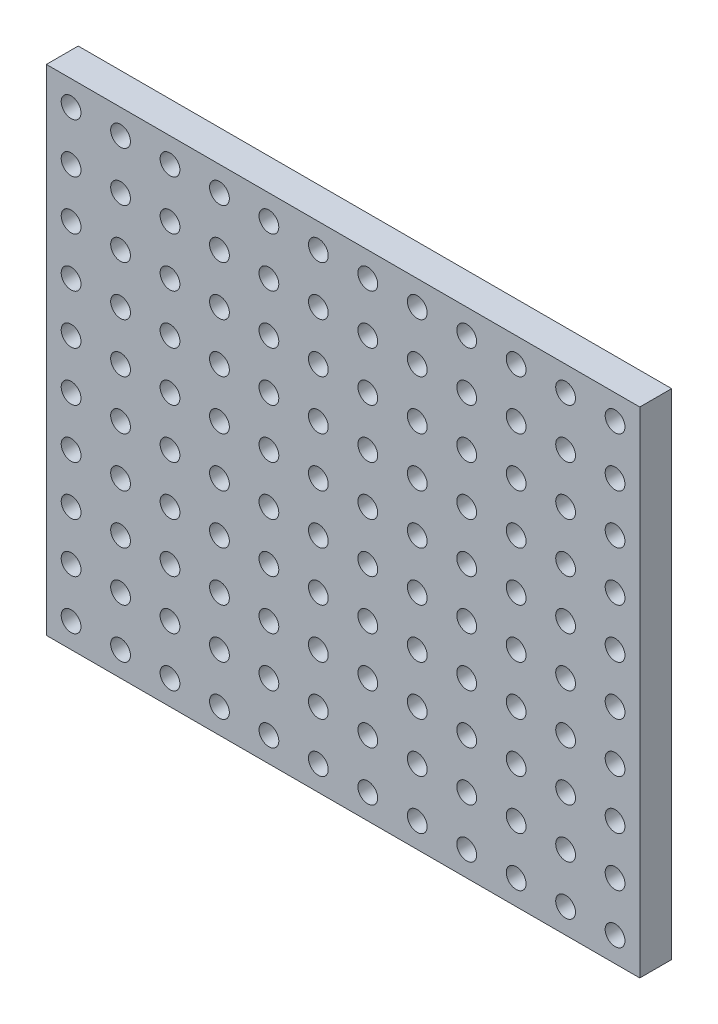
from build123d import *

# Parameters (mm, degrees)
SKETCH1_W           = 30
SKETCH1_H           = 25
SKETCH1_R           = 0.5
BOSS_EXTRUDE1_DEPTH = 1.61


with BuildPart() as part:
    # Sketch1 → Boss-Extrude1 (new body)
    with BuildSketch(Plane.XY):
        Rectangle(SKETCH1_W, SKETCH1_H)
        with Locations((-13.75, -11.25)):
            Circle(SKETCH1_R, mode=Mode.SUBTRACT)
        with Locations((-11.25, -11.25)):
            Circle(SKETCH1_R, mode=Mode.SUBTRACT)
        with Locations((-8.75, -11.25)):
            Circle(SKETCH1_R, mode=Mode.SUBTRACT)
        with Locations((-6.25, -11.25)):
            Circle(SKETCH1_R, mode=Mode.SUBTRACT)
        with Locations((-3.75, -11.25)):
            Circle(SKETCH1_R, mode=Mode.SUBTRACT)
        with Locations((-1.25, -11.25)):
            Circle(SKETCH1_R, mode=Mode.SUBTRACT)
        with Locations((1.25, -11.25)):
            Circle(SKETCH1_R, mode=Mode.SUBTRACT)
        with Locations((3.75, -11.25)):
            Circle(SKETCH1_R, mode=Mode.SUBTRACT)
        with Locations((6.25, -11.25)):
            Circle(SKETCH1_R, mode=Mode.SUBTRACT)
        with Locations((8.75, -11.25)):
            Circle(SKETCH1_R, mode=Mode.SUBTRACT)
        with Locations((11.25, -11.25)):
            Circle(SKETCH1_R, mode=Mode.SUBTRACT)
        with Locations((13.75, -11.25)):
            Circle(SKETCH1_R, mode=Mode.SUBTRACT)
        with Locations((-11.25, -8.75)):
            Circle(SKETCH1_R, mode=Mode.SUBTRACT)
        with Locations((-8.75, -8.75)):
            Circle(SKETCH1_R, mode=Mode.SUBTRACT)
        with Locations((-6.25, -8.75)):
            Circle(SKETCH1_R, mode=Mode.SUBTRACT)
        with Locations((-3.75, -8.75)):
            Circle(SKETCH1_R, mode=Mode.SUBTRACT)
        with Locations((-1.25, -8.75)):
            Circle(SKETCH1_R, mode=Mode.SUBTRACT)
        with Locations((1.25, -8.75)):
            Circle(SKETCH1_R, mode=Mode.SUBTRACT)
        with Locations((3.75, -8.75)):
            Circle(SKETCH1_R, mode=Mode.SUBTRACT)
        with Locations((6.25, -8.75)):
            Circle(SKETCH1_R, mode=Mode.SUBTRACT)
        with Locations((8.75, -8.75)):
            Circle(SKETCH1_R, mode=Mode.SUBTRACT)
        with Locations((11.25, -8.75)):
            Circle(SKETCH1_R, mode=Mode.SUBTRACT)
        with Locations((13.75, -8.75)):
            Circle(SKETCH1_R, mode=Mode.SUBTRACT)
        with Locations((-11.25, -6.25)):
            Circle(SKETCH1_R, mode=Mode.SUBTRACT)
        with Locations((-8.75, -6.25)):
            Circle(SKETCH1_R, mode=Mode.SUBTRACT)
        with Locations((-6.25, -6.25)):
            Circle(SKETCH1_R, mode=Mode.SUBTRACT)
        with Locations((-3.75, -6.25)):
            Circle(SKETCH1_R, mode=Mode.SUBTRACT)
        with Locations((-1.25, -6.25)):
            Circle(SKETCH1_R, mode=Mode.SUBTRACT)
        with Locations((1.25, -6.25)):
            Circle(SKETCH1_R, mode=Mode.SUBTRACT)
        with Locations((3.75, -6.25)):
            Circle(SKETCH1_R, mode=Mode.SUBTRACT)
        with Locations((6.25, -6.25)):
            Circle(SKETCH1_R, mode=Mode.SUBTRACT)
        with Locations((8.75, -6.25)):
            Circle(SKETCH1_R, mode=Mode.SUBTRACT)
        with Locations((11.25, -6.25)):
            Circle(SKETCH1_R, mode=Mode.SUBTRACT)
        with Locations((13.75, -6.25)):
            Circle(SKETCH1_R, mode=Mode.SUBTRACT)
        with Locations((-11.25, -3.75)):
            Circle(SKETCH1_R, mode=Mode.SUBTRACT)
        with Locations((-8.75, -3.75)):
            Circle(SKETCH1_R, mode=Mode.SUBTRACT)
        with Locations((-6.25, -3.75)):
            Circle(SKETCH1_R, mode=Mode.SUBTRACT)
        with Locations((-3.75, -3.75)):
            Circle(SKETCH1_R, mode=Mode.SUBTRACT)
        with Locations((-1.25, -3.75)):
            Circle(SKETCH1_R, mode=Mode.SUBTRACT)
        with Locations((1.25, -3.75)):
            Circle(SKETCH1_R, mode=Mode.SUBTRACT)
        with Locations((3.75, -3.75)):
            Circle(SKETCH1_R, mode=Mode.SUBTRACT)
        with Locations((6.25, -3.75)):
            Circle(SKETCH1_R, mode=Mode.SUBTRACT)
        with Locations((8.75, -3.75)):
            Circle(SKETCH1_R, mode=Mode.SUBTRACT)
        with Locations((11.25, -3.75)):
            Circle(SKETCH1_R, mode=Mode.SUBTRACT)
        with Locations((13.75, -3.75)):
            Circle(SKETCH1_R, mode=Mode.SUBTRACT)
        with Locations((-11.25, -1.25)):
            Circle(SKETCH1_R, mode=Mode.SUBTRACT)
        with Locations((-8.75, -1.25)):
            Circle(SKETCH1_R, mode=Mode.SUBTRACT)
        with Locations((-6.25, -1.25)):
            Circle(SKETCH1_R, mode=Mode.SUBTRACT)
        with Locations((-3.75, -1.25)):
            Circle(SKETCH1_R, mode=Mode.SUBTRACT)
        with Locations((-1.25, -1.25)):
            Circle(SKETCH1_R, mode=Mode.SUBTRACT)
        with Locations((1.25, -1.25)):
            Circle(SKETCH1_R, mode=Mode.SUBTRACT)
        with Locations((3.75, -1.25)):
            Circle(SKETCH1_R, mode=Mode.SUBTRACT)
        with Locations((6.25, -1.25)):
            Circle(SKETCH1_R, mode=Mode.SUBTRACT)
        with Locations((8.75, -1.25)):
            Circle(SKETCH1_R, mode=Mode.SUBTRACT)
        with Locations((11.25, -1.25)):
            Circle(SKETCH1_R, mode=Mode.SUBTRACT)
        with Locations((13.75, -1.25)):
            Circle(SKETCH1_R, mode=Mode.SUBTRACT)
        with Locations((-11.25, 1.25)):
            Circle(SKETCH1_R, mode=Mode.SUBTRACT)
        with Locations((-8.75, 1.25)):
            Circle(SKETCH1_R, mode=Mode.SUBTRACT)
        with Locations((-6.25, 1.25)):
            Circle(SKETCH1_R, mode=Mode.SUBTRACT)
        with Locations((-3.75, 1.25)):
            Circle(SKETCH1_R, mode=Mode.SUBTRACT)
        with Locations((-1.25, 1.25)):
            Circle(SKETCH1_R, mode=Mode.SUBTRACT)
        with Locations((1.25, 1.25)):
            Circle(SKETCH1_R, mode=Mode.SUBTRACT)
        with Locations((3.75, 1.25)):
            Circle(SKETCH1_R, mode=Mode.SUBTRACT)
        with Locations((6.25, 1.25)):
            Circle(SKETCH1_R, mode=Mode.SUBTRACT)
        with Locations((8.75, 1.25)):
            Circle(SKETCH1_R, mode=Mode.SUBTRACT)
        with Locations((11.25, 1.25)):
            Circle(SKETCH1_R, mode=Mode.SUBTRACT)
        with Locations((13.75, 1.25)):
            Circle(SKETCH1_R, mode=Mode.SUBTRACT)
        with Locations((-11.25, 3.75)):
            Circle(SKETCH1_R, mode=Mode.SUBTRACT)
        with Locations((-8.75, 3.75)):
            Circle(SKETCH1_R, mode=Mode.SUBTRACT)
        with Locations((-6.25, 3.75)):
            Circle(SKETCH1_R, mode=Mode.SUBTRACT)
        with Locations((-3.75, 3.75)):
            Circle(SKETCH1_R, mode=Mode.SUBTRACT)
        with Locations((-1.25, 3.75)):
            Circle(SKETCH1_R, mode=Mode.SUBTRACT)
        with Locations((1.25, 3.75)):
            Circle(SKETCH1_R, mode=Mode.SUBTRACT)
        with Locations((3.75, 3.75)):
            Circle(SKETCH1_R, mode=Mode.SUBTRACT)
        with Locations((6.25, 3.75)):
            Circle(SKETCH1_R, mode=Mode.SUBTRACT)
        with Locations((8.75, 3.75)):
            Circle(SKETCH1_R, mode=Mode.SUBTRACT)
        with Locations((11.25, 3.75)):
            Circle(SKETCH1_R, mode=Mode.SUBTRACT)
        with Locations((13.75, 3.75)):
            Circle(SKETCH1_R, mode=Mode.SUBTRACT)
        with Locations((-11.25, 6.25)):
            Circle(SKETCH1_R, mode=Mode.SUBTRACT)
        with Locations((-8.75, 6.25)):
            Circle(SKETCH1_R, mode=Mode.SUBTRACT)
        with Locations((-6.25, 6.25)):
            Circle(SKETCH1_R, mode=Mode.SUBTRACT)
        with Locations((-3.75, 6.25)):
            Circle(SKETCH1_R, mode=Mode.SUBTRACT)
        with Locations((-1.25, 6.25)):
            Circle(SKETCH1_R, mode=Mode.SUBTRACT)
        with Locations((1.25, 6.25)):
            Circle(SKETCH1_R, mode=Mode.SUBTRACT)
        with Locations((3.75, 6.25)):
            Circle(SKETCH1_R, mode=Mode.SUBTRACT)
        with Locations((6.25, 6.25)):
            Circle(SKETCH1_R, mode=Mode.SUBTRACT)
        with Locations((8.75, 6.25)):
            Circle(SKETCH1_R, mode=Mode.SUBTRACT)
        with Locations((11.25, 6.25)):
            Circle(SKETCH1_R, mode=Mode.SUBTRACT)
        with Locations((13.75, 6.25)):
            Circle(SKETCH1_R, mode=Mode.SUBTRACT)
        with Locations((-11.25, 8.75)):
            Circle(SKETCH1_R, mode=Mode.SUBTRACT)
        with Locations((-8.75, 8.75)):
            Circle(SKETCH1_R, mode=Mode.SUBTRACT)
        with Locations((-6.25, 8.75)):
            Circle(SKETCH1_R, mode=Mode.SUBTRACT)
        with Locations((-3.75, 8.75)):
            Circle(SKETCH1_R, mode=Mode.SUBTRACT)
        with Locations((-1.25, 8.75)):
            Circle(SKETCH1_R, mode=Mode.SUBTRACT)
        with Locations((1.25, 8.75)):
            Circle(SKETCH1_R, mode=Mode.SUBTRACT)
        with Locations((3.75, 8.75)):
            Circle(SKETCH1_R, mode=Mode.SUBTRACT)
        with Locations((6.25, 8.75)):
            Circle(SKETCH1_R, mode=Mode.SUBTRACT)
        with Locations((8.75, 8.75)):
            Circle(SKETCH1_R, mode=Mode.SUBTRACT)
        with Locations((11.25, 8.75)):
            Circle(SKETCH1_R, mode=Mode.SUBTRACT)
        with Locations((13.75, 8.75)):
            Circle(SKETCH1_R, mode=Mode.SUBTRACT)
        with Locations((-11.25, 11.25)):
            Circle(SKETCH1_R, mode=Mode.SUBTRACT)
        with Locations((-8.75, 11.25)):
            Circle(SKETCH1_R, mode=Mode.SUBTRACT)
        with Locations((-6.25, 11.25)):
            Circle(SKETCH1_R, mode=Mode.SUBTRACT)
        with Locations((-3.75, 11.25)):
            Circle(SKETCH1_R, mode=Mode.SUBTRACT)
        with Locations((-1.25, 11.25)):
            Circle(SKETCH1_R, mode=Mode.SUBTRACT)
        with Locations((1.25, 11.25)):
            Circle(SKETCH1_R, mode=Mode.SUBTRACT)
        with Locations((3.75, 11.25)):
            Circle(SKETCH1_R, mode=Mode.SUBTRACT)
        with Locations((6.25, 11.25)):
            Circle(SKETCH1_R, mode=Mode.SUBTRACT)
        with Locations((8.75, 11.25)):
            Circle(SKETCH1_R, mode=Mode.SUBTRACT)
        with Locations((11.25, 11.25)):
            Circle(SKETCH1_R, mode=Mode.SUBTRACT)
        with Locations((13.75, 11.25)):
            Circle(SKETCH1_R, mode=Mode.SUBTRACT)
        with Locations((-13.75, -8.75)):
            Circle(SKETCH1_R, mode=Mode.SUBTRACT)
        with Locations((-13.75, -6.25)):
            Circle(SKETCH1_R, mode=Mode.SUBTRACT)
        with Locations((-13.75, -3.75)):
            Circle(SKETCH1_R, mode=Mode.SUBTRACT)
        with Locations((-13.75, -1.25)):
            Circle(SKETCH1_R, mode=Mode.SUBTRACT)
        with Locations((-13.75, 1.25)):
            Circle(SKETCH1_R, mode=Mode.SUBTRACT)
        with Locations((-13.75, 3.75)):
            Circle(SKETCH1_R, mode=Mode.SUBTRACT)
        with Locations((-13.75, 6.25)):
            Circle(SKETCH1_R, mode=Mode.SUBTRACT)
        with Locations((-13.75, 8.75)):
            Circle(SKETCH1_R, mode=Mode.SUBTRACT)
        with Locations((-13.75, 11.25)):
            Circle(SKETCH1_R, mode=Mode.SUBTRACT)
    extrude(amount=BOSS_EXTRUDE1_DEPTH)


solid = part.part
